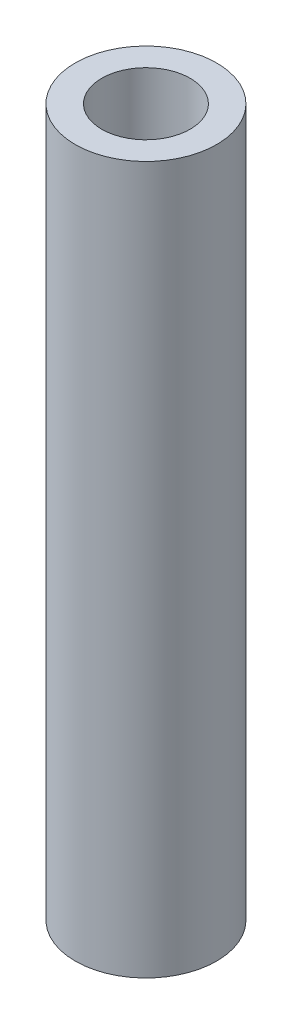
from build123d import *

# Parameters (mm, degrees)
SKETCH_1_R      = 2
SKETCH_1_R_2    = 1.25
EXTRUDE_1_DEPTH = 20


with BuildPart() as part:
    # 草图1 → 凸台-拉伸1 (new body)
    with BuildSketch(Plane(origin=(0, 0, 0), x_dir=(1, 0, 0), z_dir=(0, 1, 0))):
        with Locations(Location((0, 0, 0), (0, 0, 270))):
            Circle(SKETCH_1_R)
        with Locations(Location((0, 0, 0), (0, 0, 270))):
            Circle(SKETCH_1_R_2, mode=Mode.SUBTRACT)
    extrude(amount=EXTRUDE_1_DEPTH)


solid = part.part
